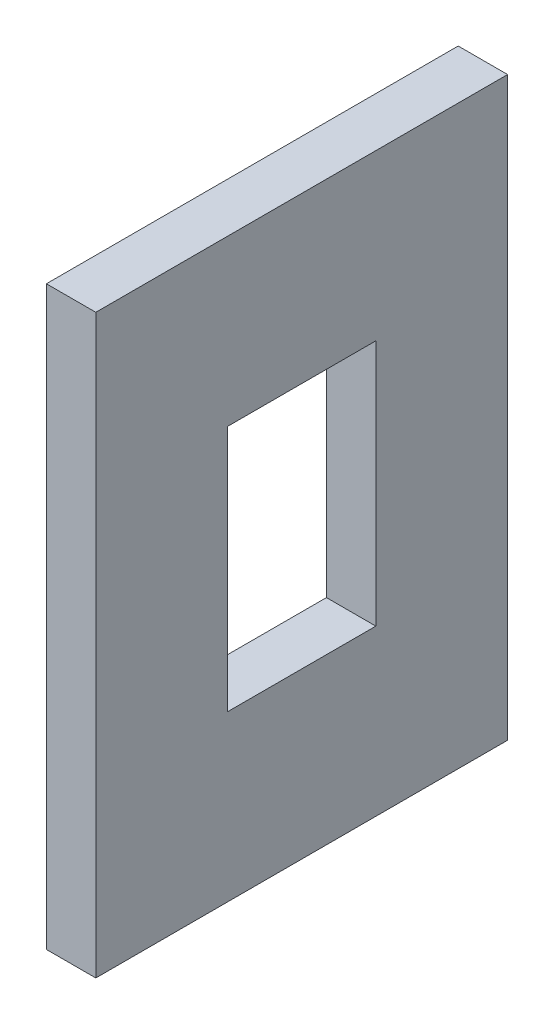
from build123d import *

# Parameters (mm, degrees)
SKETCH1_W           = 50
SKETCH1_H           = 70
BOSS_EXTRUDE1_DEPTH = 6
SKETCH2_W           = 18
SKETCH2_H           = 30
CUT_EXTRUDE1_DEPTH  = 6


with BuildPart() as part:
    # Sketch1 → Boss-Extrude1 (new body)
    with BuildSketch(Plane(origin=(0, 0, 0), x_dir=(0, 0, -1), z_dir=(1, 0, 0))):
        Rectangle(SKETCH1_W, SKETCH1_H)
    extrude(amount=BOSS_EXTRUDE1_DEPTH)

    # Sketch2 → Cut-Extrude1 (cut)
    with BuildSketch(Plane(origin=(6, 0, 0), x_dir=(0, 0, -1), z_dir=(1, 0, 0))):
        Rectangle(SKETCH2_W, SKETCH2_H)
    extrude(amount=-CUT_EXTRUDE1_DEPTH, mode=Mode.SUBTRACT)


solid = part.part
